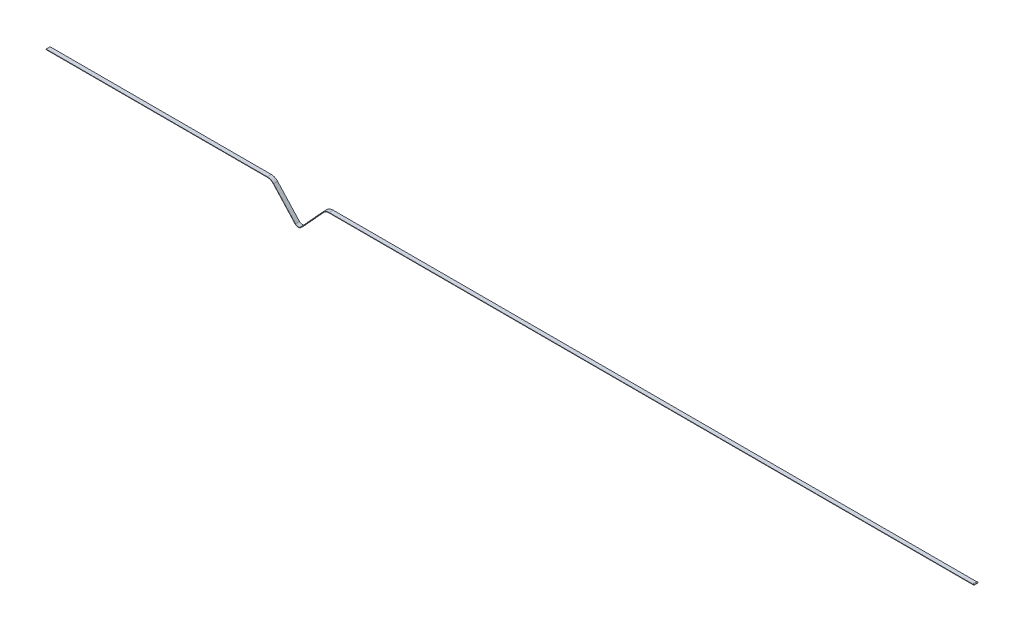
from build123d import *

# Parameters (mm, degrees)
SKETCH1_W           = 6
SKETCH1_H           = 0.63
BOSS_EXTRUDE1_DEPTH = 6


with BuildPart() as part:
    # Sweep1: sweep along a path in Sketch2
    with BuildLine(Plane.XY) as sweep1_path:
        Line((0, 0), (-953.345987996, 0))
        ThreePointArc((-953.345987996, 0), (-958.164605092, -1.014579152), (-962.165001522, -3.886036967))
        Line((-962.165001522, -3.886036967), (-994.40685218, -39.146778952))
        ThreePointArc((-994.40685218, -39.146778952), (-998.915987998, -41.133698285), (-1003.425123815, -39.14677895))
        Line((-1003.425123815, -39.14677895), (-1035.666974406, -3.886036998))
        ThreePointArc((-1035.666974406, -3.886036998), (-1039.667370864, -1.01457916), (-1044.485987996, 0))
        Line((-1044.485987996, 0), (-1371.6, 0))
    # Sketch1 → Sweep1 (sweep)
    with BuildSketch(Plane(origin=(0, 0, 0), x_dir=(0, 0, -1), z_dir=(1, 0, 0))):
        with Locations((3, 0.315)):
            Rectangle(SKETCH1_W, SKETCH1_H)
    sweep(path=sweep1_path.line)

    # Sketch3 → Boss-Extrude1 (add, through all)
    with BuildSketch(Plane.XY):
        with BuildLine():
            Line((-1.5, 0.63), (-1.5, 0))
            Line((-1.5, 0), (0, 0))
            Line((0, 0), (0, 0.63))
            ThreePointArc((0, 0.63), (-0.75, 1.38), (-1.5, 0.63))
        make_face()
    extrude(amount=-BOSS_EXTRUDE1_DEPTH)


solid = part.part
